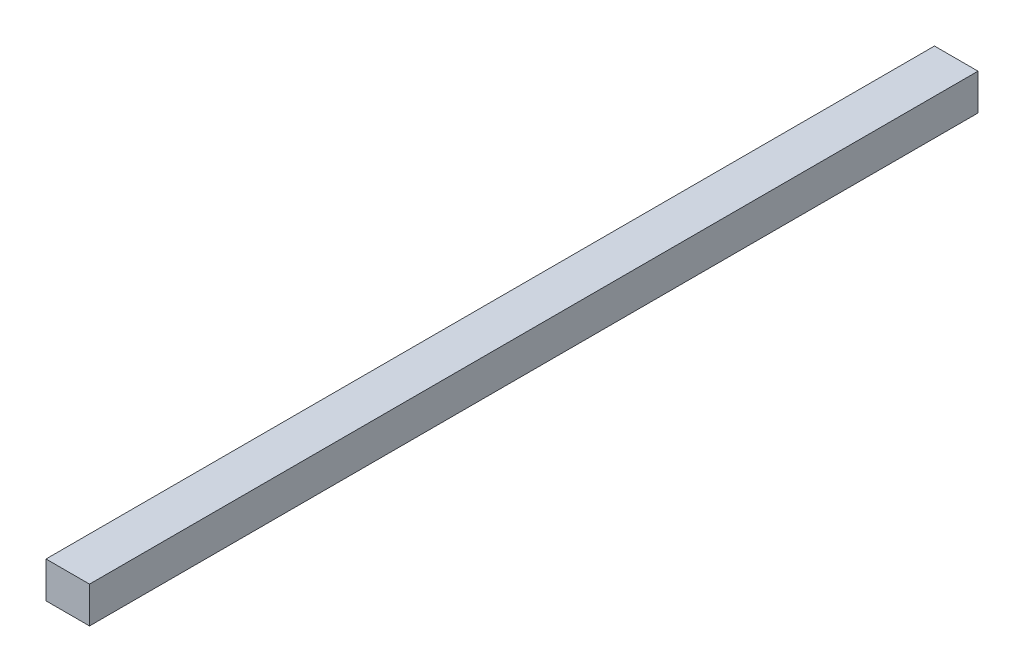
from build123d import *

# Parameters (mm, degrees)
SKETCH1_W           = 6
SKETCH1_H           = 5
BOSS_EXTRUDE1_DEPTH = 122.5


with BuildPart() as part:
    # Sketch1 → Boss-Extrude1 (new body)
    with BuildSketch(Plane.XY):
        with Locations((3, 2.5)):
            Rectangle(SKETCH1_W, SKETCH1_H)
    extrude(amount=BOSS_EXTRUDE1_DEPTH)


solid = part.part
